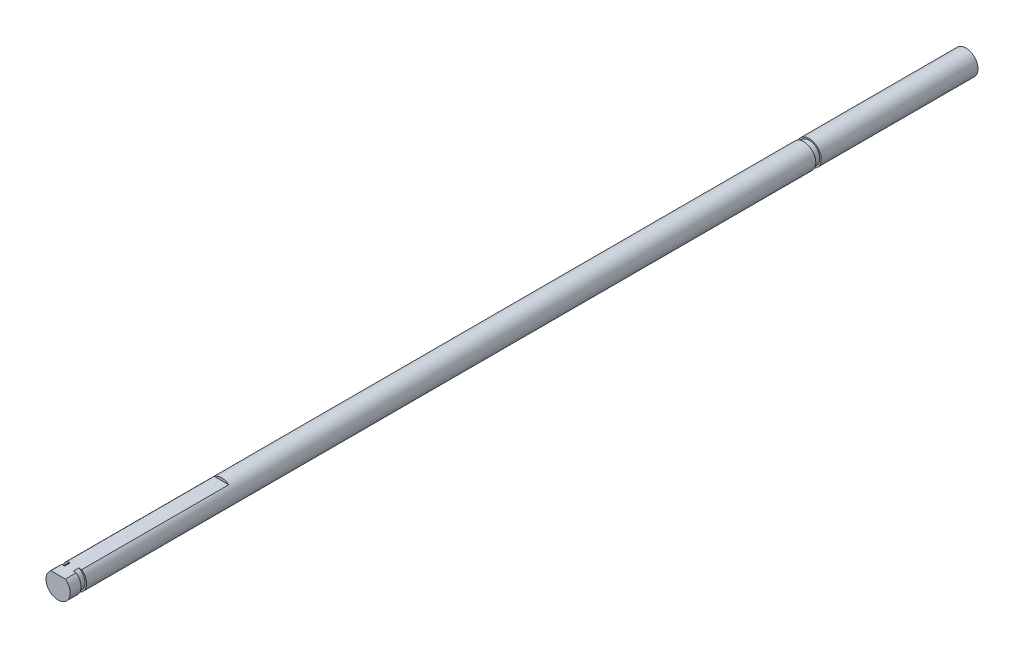
from build123d import *

# Parameters (mm, degrees)
SKIZZE1_R                       = 2
AUFSATZ_LINEAR_AUSTRAGEN1_DEPTH = 75
SKIZZE7_W                       = 0.9
SKIZZE7_H                       = 0.25
SCHNITT_LINEAR_AUSTRAGEN1_DEPTH = 27


with BuildPart() as part:
    # Skizze1 → Aufsatz-Linear austragen1 (new, symmetric)
    with BuildSketch(Plane.XY):
        Circle(SKIZZE1_R)
    extrude(amount=AUFSATZ_LINEAR_AUSTRAGEN1_DEPTH, both=True)

    # Skizze7 → Schnitt-Rotation1 (revolve, cut)
    with BuildSketch(Plane(origin=(0, 0, 0), x_dir=(0, 0, -1), z_dir=(1, 0, 0))):
        with Locations((-72.75, 1.875)):
            Rectangle(SKIZZE7_W, SKIZZE7_H)
        with Locations((48.65, 1.875)):
            Rectangle(SKIZZE7_W, SKIZZE7_H)
    revolve(axis=Axis((0, 0, -75), (0, 0, 1)), mode=Mode.SUBTRACT)

    # Skizze8 → Schnitt-Linear austragen1 (cut)
    with BuildSketch(Plane.XY.offset(75)):
        with BuildLine():
            Line((1.2, 1.6), (-1.2, 1.6))
            ThreePointArc((-1.2, 1.6), (0, 2), (1.2, 1.6))
        make_face()
    extrude(amount=-SCHNITT_LINEAR_AUSTRAGEN1_DEPTH, mode=Mode.SUBTRACT)


solid = part.part
